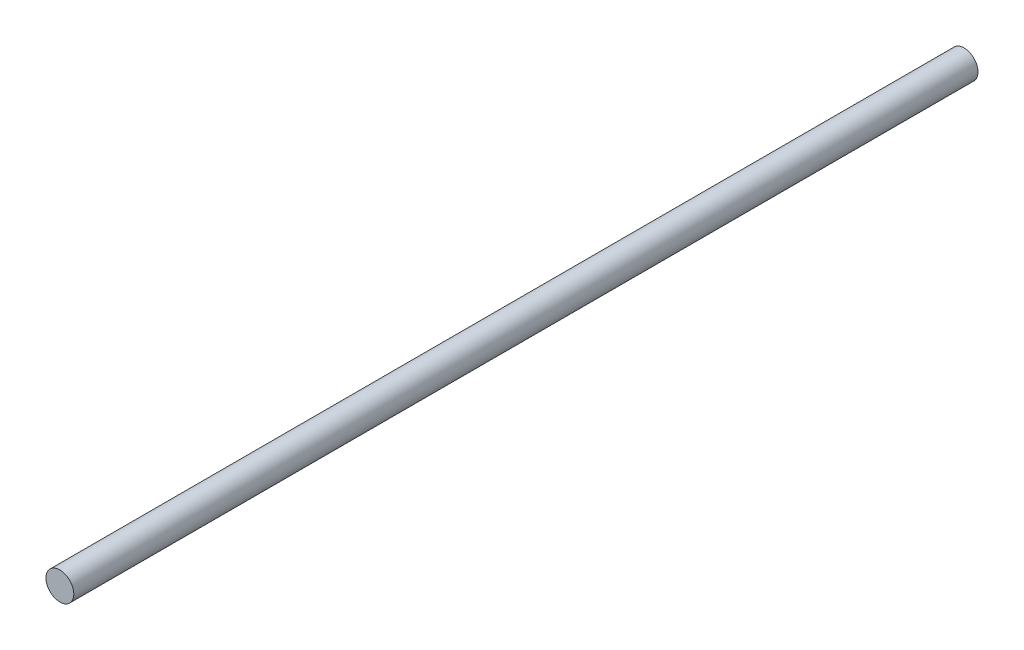
from build123d import *

# Parameters (mm, degrees)
ESBO_O1_R                = 4
RESSALTO_EXTRUS_O1_DEPTH = 130


with BuildPart() as part:
    # Esboço1 → Ressalto-extrusão1 (new, symmetric)
    with BuildSketch(Plane.XY):
        Circle(ESBO_O1_R)
    extrude(amount=RESSALTO_EXTRUS_O1_DEPTH, both=True)


solid = part.part
